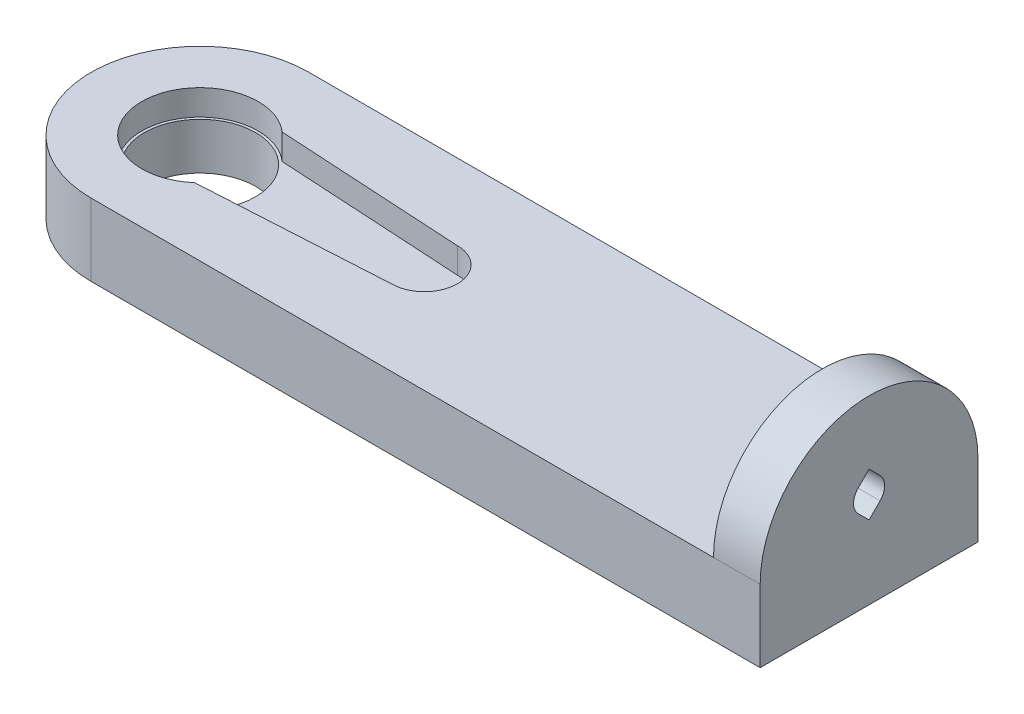
from build123d import *

# Parameters (mm, degrees)
BOSS_EXTRUDE1_DEPTH = 3
SKETCH2_R           = 3.575
CUT_EXTRUDE1_DEPTH  = 3.95
BOSS_EXTRUDE2_DEPTH = 1.64
BOSS_EXTRUDE6_DEPTH = 3
CUT_EXTRUDE8_REACH  = 53.812
SKETCH11_R          = 1


with BuildPart() as part:
    # Sketch1 → Boss-Extrude1 (new body)
    with BuildSketch(Plane(origin=(0, 0, 0), x_dir=(1, 0, 0), z_dir=(0, 1, 0))):
        with BuildLine():
            Line((0, 7), (40, 7))
            Line((40, 7), (40, -7))
            Line((40, -7), (0, -7))
            ThreePointArc((0, -7), (-7, 0), (0, 7))
        make_face()
    extrude(amount=BOSS_EXTRUDE1_DEPTH)

    # Sketch2 → Cut-Extrude1 (cut)
    with BuildSketch(Plane.XZ):
        with Locations(Location((0, 0, 0), (0, 0, 270))):
            Circle(SKETCH2_R)
    extrude(amount=-CUT_EXTRUDE1_DEPTH, mode=Mode.SUBTRACT)

    # Sketch3 → Boss-Extrude2 (add)
    with BuildSketch(Plane(origin=(0, 3, 0), x_dir=(1, 0, 0), z_dir=(0, 1, 0))):
        with BuildLine():
            Line((40, -7), (40, 7))
            Line((40, 7), (0, 7))
            ThreePointArc((0, 7), (-7, 0), (0, -7))
            Line((0, -7), (40, -7))
        make_face()
        with BuildLine():
            Line((14.43004688, 2.119993993), (2.468524523, 2.816276208))
            ThreePointArc((2.468524523, 2.816276208), (-3.745, 0), (2.468524523, -2.816276208))
            Line((2.468524523, -2.816276208), (14.43004688, -2.119993993))
            ThreePointArc((14.43004688, -2.119993993), (16.545, 0), (14.43004688, 2.119993993))
        make_face(mode=Mode.SUBTRACT)
    extrude(amount=BOSS_EXTRUDE2_DEPTH)

    # Sketch9 → Boss-Extrude6 (add)
    with BuildSketch(Plane(origin=(40, 0, 0), x_dir=(0, 0, -1), z_dir=(1, 0, 0))):
        with BuildLine():
            Line((-7, 4.64), (-7, 0))
            Line((-7, 0), (7, 0))
            Line((7, 0), (7, 4.64))
            ThreePointArc((7, 4.64), (0, 11.64), (-7, 4.64))
        make_face()
    extrude(amount=BOSS_EXTRUDE6_DEPTH)

    # Sketch11 → Cut-Extrude8 (cut, up to next)
    with BuildSketch(Plane(origin=(43, 0, 0), x_dir=(0, 0, -1), z_dir=(1, 0, 0)), mode=Mode.PRIVATE) as cut_extrude8_sk1:
        with BuildLine():
            Line((0, 7.554213562), (-0.707106782, 6.84710678))
            ThreePointArc((-0.707106782, 6.84710678), (1e-09, 7.14), (0.707106784, 6.847106778))
            Line((0.707106784, 6.847106778), (0, 7.554213562))
        make_face()
    cut_extrude8_tool1 = extrude(cut_extrude8_sk1.sketch, amount=-CUT_EXTRUDE8_REACH, mode=Mode.PRIVATE) & part.part
    # Sketch11 → Cut-Extrude8 (cut, up to next)
    with BuildSketch(Plane(origin=(43, 0, 0), x_dir=(0, 0, -1), z_dir=(1, 0, 0)), mode=Mode.PRIVATE) as cut_extrude8_sk2:
        with BuildLine():
            ThreePointArc((0.707106779, 5.432893216), (-2e-09, 5.14), (-0.707106782, 5.43289322))
            Line((-0.707106782, 5.43289322), (0, 4.725786438))
            Line((0, 4.725786438), (0.707106779, 5.432893216))
        make_face()
    cut_extrude8_tool2 = extrude(cut_extrude8_sk2.sketch, amount=-CUT_EXTRUDE8_REACH, mode=Mode.PRIVATE) & part.part
    # Sketch11 → Cut-Extrude8 (cut, up to next)
    with BuildSketch(Plane(origin=(43, 0, 0), x_dir=(0, 0, -1), z_dir=(1, 0, 0)), mode=Mode.PRIVATE) as cut_extrude8_sk3:
        with Locations((0, 6.14)):
            Circle(SKETCH11_R)
    cut_extrude8_tool3 = extrude(cut_extrude8_sk3.sketch, amount=-CUT_EXTRUDE8_REACH, mode=Mode.PRIVATE) & part.part
    add(cut_extrude8_tool1.solids().sort_by_distance((43, 7.238324, 0))[0], mode=Mode.SUBTRACT)
    add(cut_extrude8_tool2.solids().sort_by_distance((43, 5.041676, 0))[0], mode=Mode.SUBTRACT)
    add(cut_extrude8_tool3.solids().sort_by_distance((43, 6.14, 0))[0], mode=Mode.SUBTRACT)


solid = part.part
